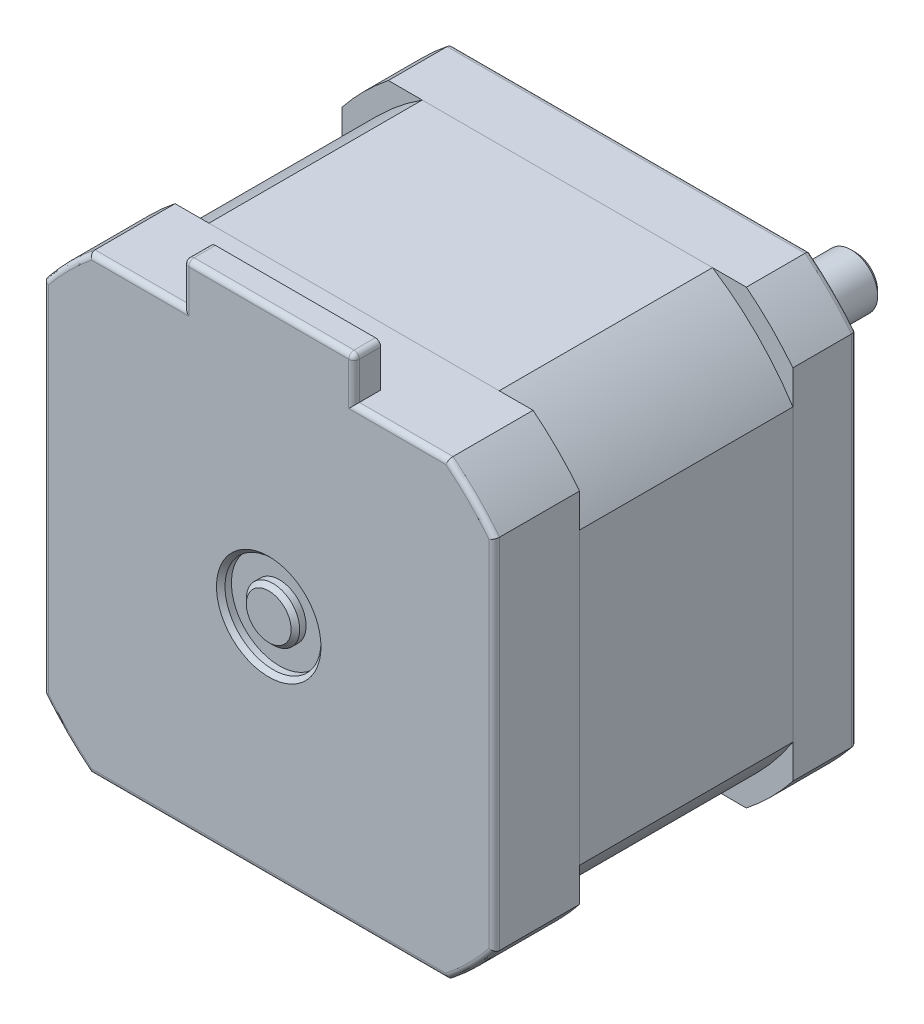
from build123d import *

# Parameters (mm, degrees)
BOSS_EXTRU_1_DEPTH           = 6
BOSS_EXTRU_2_DEPTH           = 20
BOSS_EXTRU_3_DEPTH           = 8
ESQUISSE4_W                  = 16
ESQUISSE4_H                  = 2.5
BOSS_EXTRU_4_DEPTH           = 4
ESQUISSE5_W                  = 2
ESQUISSE5_H                  = 6.5
ESQUISSE5_W_2                = 21
ESQUISSE5_H_2                = 2.5
CONG_1_R                     = 0.5
CONG_2_R                     = 0.5
CHANFREIN1_SIZE              = 0.4
CHANFREIN2_SIZE              = 0.4
ENL_V_MAT_EXTRU_1_DEPTH      = 48.284722808
ENL_V_MAT_EXTRU_1_DEPTH_BACK = 48.284722808
ESQUISSE6_W                  = 18
ESQUISSE6_H                  = 0.5
ESQUISSE7_R                  = 4.5
ESQUISSE7_R_2                = 2.5
ENL_V_MAT_EXTRU_2_DEPTH      = 1
CHANFREIN3_SIZE              = 0.4
TROU_TARAUD_M31_AT_2_COUNT   = 2
TROU_TARAUD_M31_AT_2_PITCH   = 31
TROU_TARAUD_M31_AT_3_COUNT   = 2
TROU_TARAUD_M31_AT_3_PITCH   = 43.840620434
TROU_TARAUD_M31_AT_4_COUNT   = 2
TROU_TARAUD_M31_AT_4_PITCH   = 31


with BuildPart() as part:
    # Esquisse1 → Boss.-Extru.1 (new body)
    with BuildSketch(Plane.XY):
        with BuildLine():
            Line((21.15, 16.783250579), (21.15, -16.783250579))
            ThreePointArc((21.15, -16.783250579), (19.091883092, -19.091883092), (16.783250579, -21.15))
            Line((16.783250579, -21.15), (-16.783250579, -21.15))
            ThreePointArc((-16.783250579, -21.15), (-19.091883092, -19.091883092), (-21.15, -16.783250579))
            Line((-21.15, -16.783250579), (-21.15, 16.783250579))
            ThreePointArc((-21.15, 16.783250579), (-19.091883092, 19.091883092), (-16.783250579, 21.15))
            Line((-16.783250579, 21.15), (16.783250579, 21.15))
            ThreePointArc((16.783250579, 21.15), (19.091883092, 19.091883092), (21.15, 16.783250579))
        make_face()
    extrude(amount=BOSS_EXTRU_1_DEPTH)

    # Congé2
    cong_2_edges = [part.edges().sort_by_distance(p)[0] for p in [
        (0, 21.15, 0),
        (19.091883092, 19.091883092, 0),
        (21.15, 0, 0),
        (19.091883092, -19.091883092, 0),
        (0, -21.15, 0),
        (-19.091883092, -19.091883092, 0),
        (-21.15, 0, 0),
        (-19.091883092, 19.091883092, 0),
    ]]
    fillet(cong_2_edges, radius=CONG_2_R)

    # Esquisse9 → Trou taraudé M31 (revolve, cut)
    with BuildSketch(Plane(origin=(15.5, -15.5, 0), x_dir=(0, 1, 0), z_dir=(1, 0, 0))):
        Polygon((0, 0), (0, 5.751075774), (1.25, 5), (1.25, 0), align=None)
    trou_taraud_m31 = revolve(axis=Axis((15.5, -15.5, -6.35), (0, 0, 1)), mode=Mode.SUBTRACT)

    # Trou taraudé M31 at 2: Trou taraudé M31 ×2
    with Locations(*[(0, i * TROU_TARAUD_M31_AT_2_PITCH, 0) for i in range(1, TROU_TARAUD_M31_AT_2_COUNT)]):
        add(trou_taraud_m31, mode=Mode.SUBTRACT)

    # Trou taraudé M31 at 3: Trou taraudé M31 ×2
    with Locations(*[Vector(-0.7071067811865476, 0.7071067811865476, 0) * (i * TROU_TARAUD_M31_AT_3_PITCH) for i in range(1, TROU_TARAUD_M31_AT_3_COUNT)]):
        add(trou_taraud_m31, mode=Mode.SUBTRACT)

    # Trou taraudé M31 at 4: Trou taraudé M31 ×2
    with Locations(*[(-i * TROU_TARAUD_M31_AT_4_PITCH, 0, 0) for i in range(1, TROU_TARAUD_M31_AT_4_COUNT)]):
        add(trou_taraud_m31, mode=Mode.SUBTRACT)


with BuildPart() as body_2:
    # Esquisse2 → Boss.-Extru.2 (new body)
    with BuildSketch(Plane.XY.offset(6)):
        with BuildLine():
            Line((-13.608820669, 21.15), (13.608820669, 21.15))
            ThreePointArc((13.608820669, 21.15), (17.783735547, 17.783735547), (21.15, 13.608820669))
            Line((21.15, 13.608820669), (21.15, -13.608820669))
            ThreePointArc((21.15, -13.608820669), (17.783735547, -17.783735547), (13.608820669, -21.15))
            Line((13.608820669, -21.15), (-13.608820669, -21.15))
            ThreePointArc((-13.608820669, -21.15), (-17.783735547, -17.783735547), (-21.15, -13.608820669))
            Line((-21.15, -13.608820669), (-21.15, 13.608820669))
            ThreePointArc((-21.15, 13.608820669), (-17.783735547, 17.783735547), (-13.608820669, 21.15))
        make_face()
    extrude(amount=BOSS_EXTRU_2_DEPTH)


with BuildPart() as body_3:
    # Esquisse3 → Boss.-Extru.3 (new body)
    with BuildSketch(Plane.XY.offset(26)):
        with BuildLine():
            Line((-16.783250579, -21.15), (16.783250579, -21.15))
            ThreePointArc((16.783250579, -21.15), (19.091883092, -19.091883092), (21.15, -16.783250579))
            Line((21.15, -16.783250579), (21.15, 16.783250579))
            ThreePointArc((21.15, 16.783250579), (19.091883092, 19.091883092), (16.783250579, 21.15))
            Line((16.783250579, 21.15), (-16.783250579, 21.15))
            ThreePointArc((-16.783250579, 21.15), (-19.091883092, 19.091883092), (-21.15, 16.783250579))
            Line((-21.15, 16.783250579), (-21.15, -16.783250579))
            ThreePointArc((-21.15, -16.783250579), (-19.091883092, -19.091883092), (-16.783250579, -21.15))
        make_face()
    extrude(amount=BOSS_EXTRU_3_DEPTH)

    # Esquisse4 → Boss.-Extru.4 (add)
    with BuildSketch(Plane(origin=(0, 21.15, 0), x_dir=(1, 0, 0), z_dir=(0, 1, 0))):
        with Locations((0, -32.75)):
            Rectangle(ESQUISSE4_W, ESQUISSE4_H)
    extrude(amount=BOSS_EXTRU_4_DEPTH)

    # Congé1
    cong_1_edges = [body_3.edges().sort_by_distance(p)[0] for p in [
        (19.091883092, -19.091883092, 34),
        (21.15, 0, 34),
        (19.091883092, 19.091883092, 34),
        (12.39162529, 21.15, 34),
        (-19.091883092, 19.091883092, 34),
        (-21.15, 0, 34),
        (-12.39162529, 21.15, 34),
        (8, 23.15, 34),
        (-8, 23.15, 34),
        (8, 25.15, 32.75),
        (-8, 25.15, 32.75),
        (0, 25.15, 34),
        (-19.091883092, -19.091883092, 34),
        (0, -21.15, 34),
    ]]
    fillet(cong_1_edges, radius=CONG_1_R)

    # Esquisse7 → Enlèv. mat.-Extru.2 (cut)
    with BuildSketch(Plane.XY.offset(34)):
        with Locations(Location((0, 0, 0), (0, 0, 180))):
            Circle(ESQUISSE7_R)
        with Locations(Location((0, 0, 0), (0, 0, 180))):
            Circle(ESQUISSE7_R_2, mode=Mode.SUBTRACT)
    extrude(amount=-ENL_V_MAT_EXTRU_2_DEPTH, mode=Mode.SUBTRACT)

    # Chanfrein3
    chanfrein3_edges = [body_3.edges().sort_by_distance(p)[0] for p in [
        (4.5, 0, 34),
        (2.5, 0, 34),
    ]]
    chamfer(chanfrein3_edges, length=CHANFREIN3_SIZE)


with BuildPart() as body_4:
    # Esquisse5 → Révolution1 (revolve)
    with BuildSketch(Plane(origin=(0, 0, 0), x_dir=(0, 0, -1), z_dir=(1, 0, 0)), mode=Mode.PRIVATE) as r_volution1_sk:
        with Locations((1, 7.75)):
            Rectangle(ESQUISSE5_W, ESQUISSE5_H)
        with Locations((10.5, 1.25)):
            Rectangle(ESQUISSE5_W_2, ESQUISSE5_H_2)
    revolve(r_volution1_sk.sketch.rotate(Axis((0, 0, 0), (0, 0, 1)), 90), axis=Axis((0, 0, 0), (0, 0, 1)))

    # Chanfrein1
    chanfrein1_edges = [body_4.edges().sort_by_distance(p)[0] for p in [
        (2.5, 0, -21),
    ]]
    chamfer(chanfrein1_edges, length=CHANFREIN1_SIZE)

    # Chanfrein2
    chanfrein2_edges = [body_4.edges().sort_by_distance(p)[0] for p in [
        (11, 0, -2),
        (4.5, 0, -2),
    ]]
    chamfer(chanfrein2_edges, length=CHANFREIN2_SIZE)

    # Esquisse6 → Enlèv. mat.-Extru.1 (cut, two sides: drawn at the far end of the back side and taken through both)
    with BuildSketch(Plane(origin=(0, 0, 0), x_dir=(0, 0, -1), z_dir=(0, 1, 0)).offset(-ENL_V_MAT_EXTRU_1_DEPTH_BACK)):
        with Locations((12, 2.25)):
            Rectangle(ESQUISSE6_W, ESQUISSE6_H)
    extrude(amount=ENL_V_MAT_EXTRU_1_DEPTH + ENL_V_MAT_EXTRU_1_DEPTH_BACK, mode=Mode.SUBTRACT)


solid = Compound([part.part, body_2.part, body_3.part, body_4.part])
